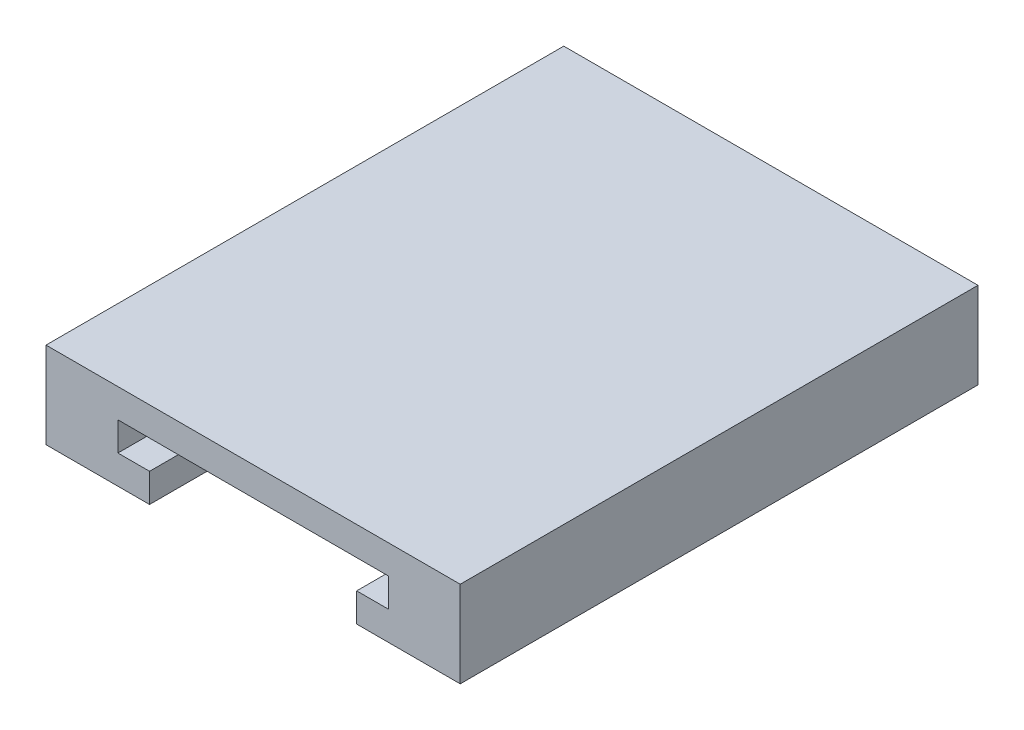
from build123d import *

# Parameters (mm, degrees)
SKETCH1_W           = 6.25
SKETCH1_H           = 2.5
SKETCH1_W_2         = 9
BOSS_EXTRUDE1_DEPTH = 45


with BuildPart() as part:
    # Sketch1 → Boss-Extrude1 (new body)
    with BuildSketch(Plane.XY):
        Polygon((-3.202898551, 2.789855072), (-3.202898551, 0.289855072), (3.047101449, 0.289855072), (14.797101449, 0.289855072), (14.797101449, 2.789855072), align=None)
        with Locations((-0.077898551, -0.960144928)):
            Rectangle(SKETCH1_W, SKETCH1_H)
        with Locations((1.297101449, -3.460144928)):
            Rectangle(SKETCH1_W_2, SKETCH1_H)
    boss_extrude1 = extrude(amount=BOSS_EXTRUDE1_DEPTH)

    # Mirror1: Boss-Extrude1 across plane
    add(boss_extrude1.mirror(Plane(origin=(14.797101449, 0, 45), x_dir=(0, 0, 1), z_dir=(-1, 0, 0))))

    # Cut-Extrude1 cone 1 section (through the dimple's axis) → Cut-Extrude1 (revolve, cut)
    with BuildSketch(Plane(origin=(14.797101449, 0.289855072, 32.5), x_dir=(0, 0, -1), z_dir=(1, 0, 0))):
        Polygon((0, 0), (1.25, 0), (0, 1.25), align=None)
    revolve(axis=Axis((14.797101449, 0.289855072, 32.5), (0, 1, 0)), mode=Mode.SUBTRACT)

    # Cut-Extrude1 cone 2 section (through the dimple's axis) → Cut-Extrude1 cone 2 (revolve, cut)
    with BuildSketch(Plane(origin=(14.797101449, 0.289855072, 12.5), x_dir=(0, 0, -1), z_dir=(1, 0, 0))):
        Polygon((0, 0), (1.25, 0), (0, 1.25), align=None)
    revolve(axis=Axis((14.797101449, 0.289855072, 12.5), (0, 1, 0)), mode=Mode.SUBTRACT)


solid = part.part
